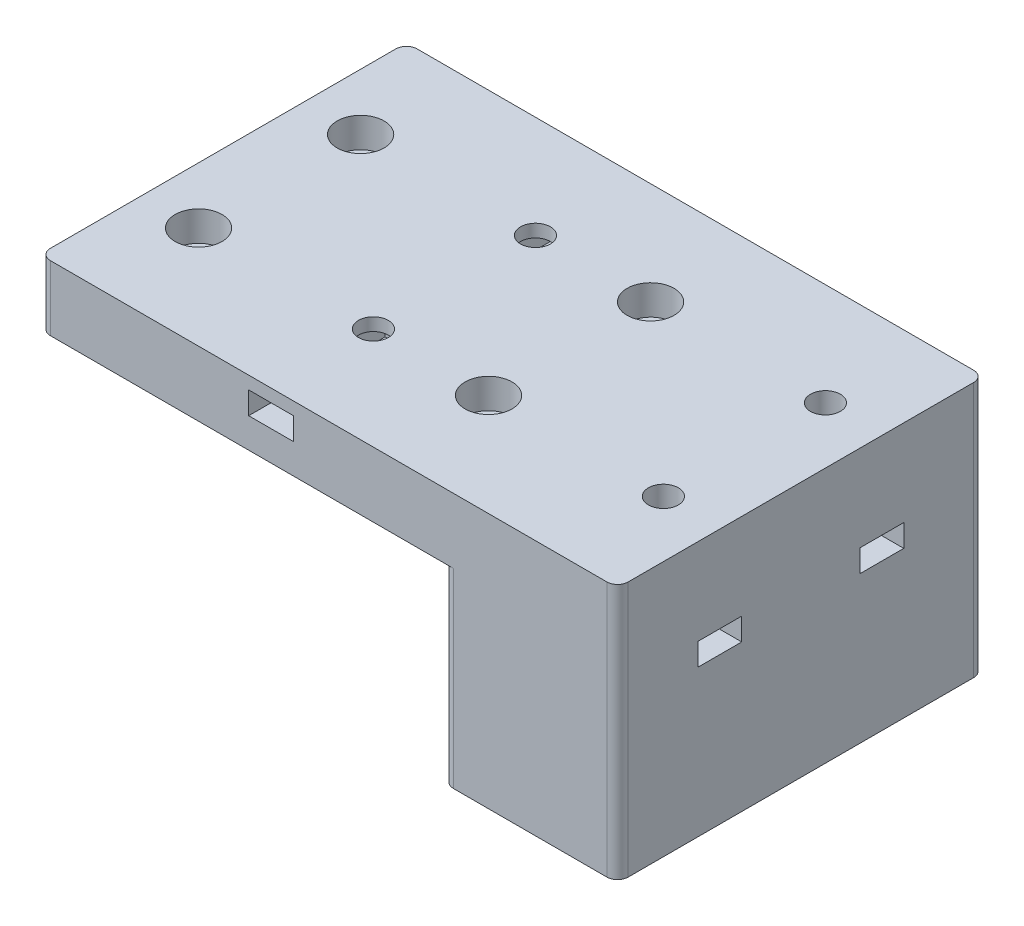
from build123d import *

# Parameters (mm, degrees)
BOSS_EXTRUDE1_DEPTH  = 43
M6_CLEARANCE_HOLE1_D = 7
SKETCH4_R            = 5.5
CUT_EXTRUDE1_DEPTH   = 7
SKETCH5_W            = 10.25
SKETCH5_H            = 5.25
CUT_EXTRUDE2_DEPTH   = 22
SKETCH6_W            = 10.5
SKETCH6_H            = 5.25
CUT_EXTRUDE3_DEPTH   = 32
FILLET1_R            = 2.5


with BuildPart() as part:
    # Sketch1 → Boss-Extrude1 (new, symmetric)
    with BuildSketch(Plane.XY):
        Polygon((0, 0), (0, -44.7), (41, -44.7), (41, 15.25), (-94.5, 15.25), (-94.5, 0), align=None)
    extrude(amount=BOSS_EXTRUDE1_DEPTH, both=True)

    # M6 Clearance Hole1 (through all)
    with Locations(Plane(origin=(0, 15.25, 0), x_dir=(1, 0, 0), z_dir=(0, 1, 0))):
        with Locations((-81.25, 19), (-81.25, -19), (-13.25, -19), (-13.25, 19), (27.75, 19), (27.75, -19), (-40.25, 19), (-40.25, -19)):
            Hole(M6_CLEARANCE_HOLE1_D / 2)

    # Sketch4 → Cut-Extrude1 (cut)
    with BuildSketch(Plane(origin=(0, 15.25, 0), x_dir=(1, 0, 0), z_dir=(0, 1, 0))):
        with Locations(Location((-81.25, 19, 0), (0, 0, 180))):
            Circle(SKETCH4_R)
        with Locations(Location((-81.25, -19, 0), (0, 0, 180))):
            Circle(SKETCH4_R)
        with Locations(Location((-13.25, 19, 0), (0, 0, 180))):
            Circle(SKETCH4_R)
        with Locations(Location((-13.25, -19, 0), (0, 0, 180))):
            Circle(SKETCH4_R)
    extrude(amount=-CUT_EXTRUDE1_DEPTH, mode=Mode.SUBTRACT)

    # Sketch5 → Cut-Extrude2 (cut)
    with BuildSketch(Plane(origin=(41, 0, 0), x_dir=(0, 0, -1), z_dir=(1, 0, 0))):
        with Locations((-19, -7.625)):
            Rectangle(SKETCH5_W, SKETCH5_H)
        with Locations((19, -7.625)):
            Rectangle(SKETCH5_W, SKETCH5_H)
    extrude(amount=-CUT_EXTRUDE2_DEPTH, mode=Mode.SUBTRACT)

    # Sketch6 → Cut-Extrude3 (cut)
    with BuildSketch(Plane.XY.offset(43)):
        with Locations((-40.25, 9.625)):
            Rectangle(SKETCH6_W, SKETCH6_H)
    cut_extrude3 = extrude(amount=-CUT_EXTRUDE3_DEPTH, mode=Mode.SUBTRACT)

    # Mirror1: Cut-Extrude3 across plane
    add(cut_extrude3.mirror(Plane.XY), mode=Mode.SUBTRACT)

    # Fillet1
    fillet1_edges = [part.edges().sort_by_distance(p)[0] for p in [
        (41, -14.725, 43),
        (-94.5, 7.625, 43),
        (-94.5, 7.625, -43),
        (41, -14.725, -43),
        (0, -22.35, -43),
        (0, -22.35, 43),
    ]]
    fillet(fillet1_edges, radius=FILLET1_R)


solid = part.part
